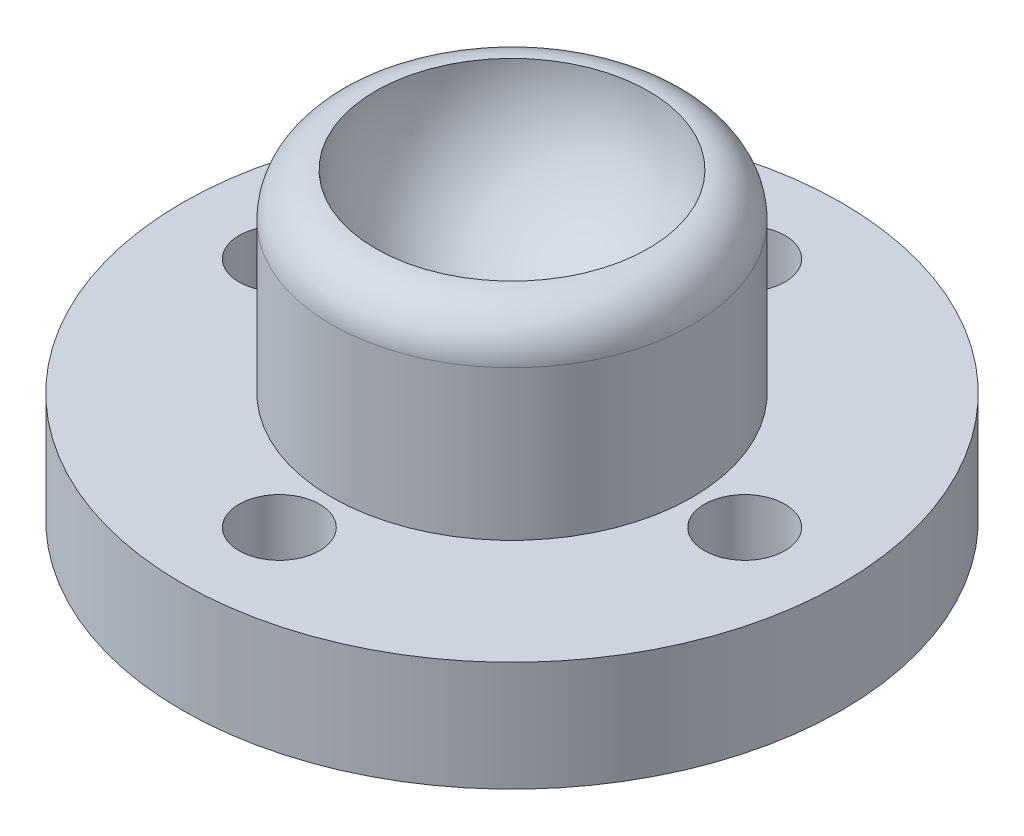
from build123d import *

# Parameters (mm, degrees)
SKETCH2_R           = 19.05
SKETCH2_R_2         = 6.688770164
SKETCH2_R_3         = 2.328803663
BOSS_EXTRUDE1_DEPTH = 6.35
SKETCH3_R           = 10.424468921
BOSS_EXTRUDE2_DEPTH = 11.176
FILLET1_R           = 2.54


with BuildPart() as part:
    # Sketch2 → Boss-Extrude1 (new body)
    with BuildSketch(Plane(origin=(0, 0, 0), x_dir=(1, 0, 0), z_dir=(0, 1, 0))):
        with Locations(Location((0, 0, 0), (0, 0, 270))):
            Circle(SKETCH2_R)
        with Locations(Location((0, 0, 0), (0, 0, 270))):
            Circle(SKETCH2_R_2, mode=Mode.SUBTRACT)
        with Locations(Location((0, 13.4441798, 0), (0, 0, 270))):
            Circle(SKETCH2_R_3, mode=Mode.SUBTRACT)
        with Locations(Location((13.4441798, 0, 0), (0, 0, 270))):
            Circle(SKETCH2_R_3, mode=Mode.SUBTRACT)
        with Locations(Location((0, -13.4441798, 0), (0, 0, 270))):
            Circle(SKETCH2_R_3, mode=Mode.SUBTRACT)
        with Locations(Location((-13.4441798, 0, 0), (0, 0, 270))):
            Circle(SKETCH2_R_3, mode=Mode.SUBTRACT)
    extrude(amount=BOSS_EXTRUDE1_DEPTH)

    # Sketch3 → Boss-Extrude2 (add)
    with BuildSketch(Plane(origin=(0, 6.35, 0), x_dir=(1, 0, 0), z_dir=(0, 1, 0))):
        with Locations(Location((0, 0, 0), (0, 0, 270))):
            Circle(SKETCH3_R)
    extrude(amount=BOSS_EXTRUDE2_DEPTH)

    # Fillet1
    fillet1_edges = [part.edges().sort_by_distance(p)[0] for p in [
        (0, 17.526, -10.424468921),
    ]]
    fillet(fillet1_edges, radius=FILLET1_R)


with BuildPart() as body_2:
    # Sketch5 → Revolve1 (revolve)
    with BuildSketch(Plane(origin=(0, 17.526, 0), x_dir=(1, 0, 0), z_dir=(0, 1, 0))):
        with BuildLine():
            Line((0, 7.884468921), (0, -7.884468921))
            ThreePointArc((0, -7.884468921), (7.884468921, 0), (0, 7.884468921))
        make_face()
    revolve(axis=Axis((0, 17.526, -14.295685005), (0, 0, 1)))


with BuildPart() as part_1:
    add(part.part)

    # Combine1: cut body 2
    add(body_2.part, mode=Mode.SUBTRACT)


solid = part_1.part
